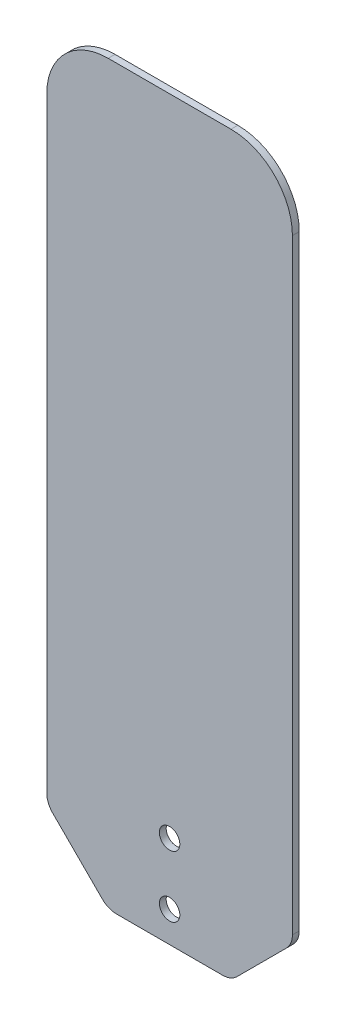
from build123d import *

# Parameters (mm, degrees)
MODEL_R                 = 1.5
SALIENTE_EXTRUIR1_DEPTH = 1


with BuildPart() as part:
    # Model → Saliente-Extruir1 (new body)
    with BuildSketch(Plane.XY):
        with BuildLine():
            Line((91.392530772, 168.7618816), (106.907249398, 168.7618816))
            ThreePointArc((106.907249398, 168.7618816), (108.055299695, 168.990243002), (109.028569741, 169.640561256))
            Line((109.028569741, 169.640561256), (116.271210428, 176.883201943))
            ThreePointArc((116.271210428, 176.883201943), (116.921528682, 177.85647199), (117.149890085, 179.004522287))
            Line((117.149890085, 179.004522287), (117.149890085, 267.764522287))
            ThreePointArc((117.149890085, 267.764522287), (114.513851116, 274.128483317), (108.149890085, 276.764522287))
            Line((108.149890085, 276.764522287), (90.149890085, 276.764522287))
            ThreePointArc((90.149890085, 276.764522287), (83.785929054, 274.128483317), (81.149890085, 267.764522287))
            Line((81.149890085, 267.764522287), (81.149890085, 179.004522287))
            ThreePointArc((81.149890085, 179.004522287), (81.378251487, 177.85647199), (82.028569741, 176.883201943))
            Line((82.028569741, 176.883201943), (89.271210428, 169.640561256))
            ThreePointArc((89.271210428, 169.640561256), (90.244480475, 168.990243002), (91.392530772, 168.7618816))
        make_face()
        with Locations((99.149890085, 173.2618816)):
            Circle(MODEL_R, mode=Mode.SUBTRACT)
        with Locations((99.149890085, 182.2618816)):
            Circle(MODEL_R, mode=Mode.SUBTRACT)
    extrude(amount=SALIENTE_EXTRUIR1_DEPTH)


solid = part.part
